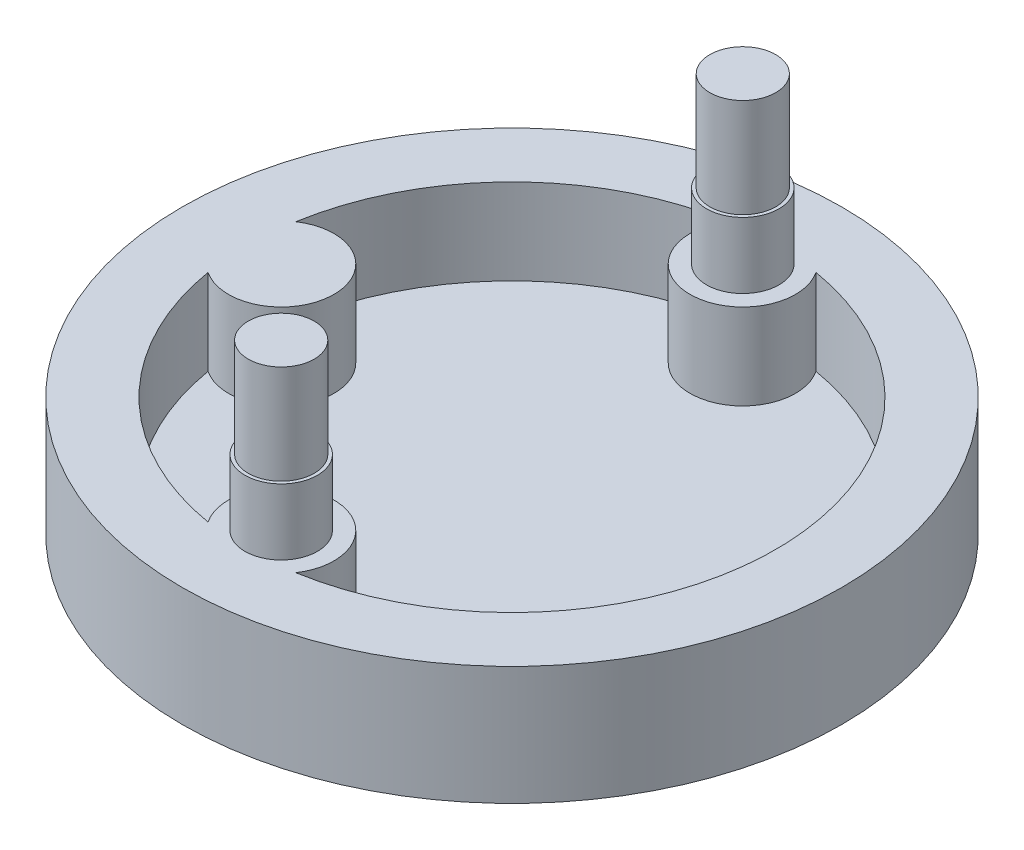
from build123d import *

# Parameters (mm, degrees)
SKETCH1_R           = 50
BOSS_EXTRUDE1_DEPTH = 18
CUT_EXTRUDE1_START  = 5
SKETCH1_3_R         = 40
CUT_EXTRUDE1_DEPTH  = 13
BOSS_EXTRUDE2_REACH = 74.966
SKETCH2_R           = 8
SKETCH3_R           = 5.5
BOSS_EXTRUDE3_DEPTH = 10
SKETCH4_R           = 5
BOSS_EXTRUDE4_DEPTH = 15
SKETCH5_R           = 4
CUT_EXTRUDE2_DEPTH  = 18
SKETCH5_3_R         = 4
CUT_EXTRUDE3_DEPTH  = 8


with BuildPart() as part:
    # Sketch1 → Boss-Extrude1 (new body)
    with BuildSketch(Plane(origin=(0, 0, 0), x_dir=(1, 0, 0), z_dir=(0, 1, 0))):
        Circle(SKETCH1_R)
    extrude(amount=BOSS_EXTRUDE1_DEPTH)

    # Sketch1<3> → Cut-Extrude1 (cut)
    with BuildSketch(Plane(origin=(0, 0, 0), x_dir=(1, 0, 0), z_dir=(0, 1, 0)).offset(CUT_EXTRUDE1_START)):
        Circle(SKETCH1_3_R)
    extrude(amount=CUT_EXTRUDE1_DEPTH, mode=Mode.SUBTRACT)

    # Sketch2 → Boss-Extrude2 (add, up to next)
    with BuildSketch(Plane(origin=(0, 18, 0), x_dir=(1, 0, 0), z_dir=(0, 1, 0)), mode=Mode.PRIVATE) as boss_extrude2_sk1:
        with Locations((0, 35)):
            Circle(SKETCH2_R)
    boss_extrude2_tool1 = extrude(boss_extrude2_sk1.sketch, amount=-BOSS_EXTRUDE2_REACH, mode=Mode.PRIVATE) - part.part
    # Sketch2 → Boss-Extrude2 (add, up to next)
    with BuildSketch(Plane(origin=(0, 18, 0), x_dir=(1, 0, 0), z_dir=(0, 1, 0)), mode=Mode.PRIVATE) as boss_extrude2_sk2:
        with Locations((0, -35)):
            Circle(SKETCH2_R)
    boss_extrude2_tool2 = extrude(boss_extrude2_sk2.sketch, amount=-BOSS_EXTRUDE2_REACH, mode=Mode.PRIVATE) - part.part
    # Sketch2 → Boss-Extrude2 (add, up to next)
    with BuildSketch(Plane(origin=(0, 18, 0), x_dir=(1, 0, 0), z_dir=(0, 1, 0)), mode=Mode.PRIVATE) as boss_extrude2_sk3:
        with Locations((-35, 0)):
            Circle(SKETCH2_R)
    boss_extrude2_tool3 = extrude(boss_extrude2_sk3.sketch, amount=-BOSS_EXTRUDE2_REACH, mode=Mode.PRIVATE) - part.part
    add(boss_extrude2_tool1.solids().sort_by_distance((0, 18, -35))[0])
    add(boss_extrude2_tool2.solids().sort_by_distance((0, 18, 35))[0])
    add(boss_extrude2_tool3.solids().sort_by_distance((-35, 18, 0))[0])

    # Sketch3 → Boss-Extrude3 (add)
    with BuildSketch(Plane(origin=(0, 18, 0), x_dir=(1, 0, 0), z_dir=(0, 1, 0))):
        with Locations((0, 35)):
            Circle(SKETCH3_R)
        with Locations((0, -35)):
            Circle(SKETCH3_R)
    extrude(amount=BOSS_EXTRUDE3_DEPTH)

    # Sketch4 → Boss-Extrude4 (add)
    with BuildSketch(Plane(origin=(0, 28, 0), x_dir=(1, 0, 0), z_dir=(0, 1, 0))):
        with Locations((0, -35)):
            Circle(SKETCH4_R)
        with Locations((0, 35)):
            Circle(SKETCH4_R)
    extrude(amount=BOSS_EXTRUDE4_DEPTH)

    # Sketch5 → Cut-Extrude2 (cut)
    with BuildSketch(Plane.XZ):
        with Locations((0, 35)):
            Circle(SKETCH5_R)
        with Locations((0, -35)):
            Circle(SKETCH5_R)
    extrude(amount=-CUT_EXTRUDE2_DEPTH, mode=Mode.SUBTRACT)

    # Sketch5<3> → Cut-Extrude3 (cut)
    with BuildSketch(Plane.XZ):
        with Locations((-35, 0)):
            Circle(SKETCH5_3_R)
    extrude(amount=-CUT_EXTRUDE3_DEPTH, mode=Mode.SUBTRACT)


solid = part.part
